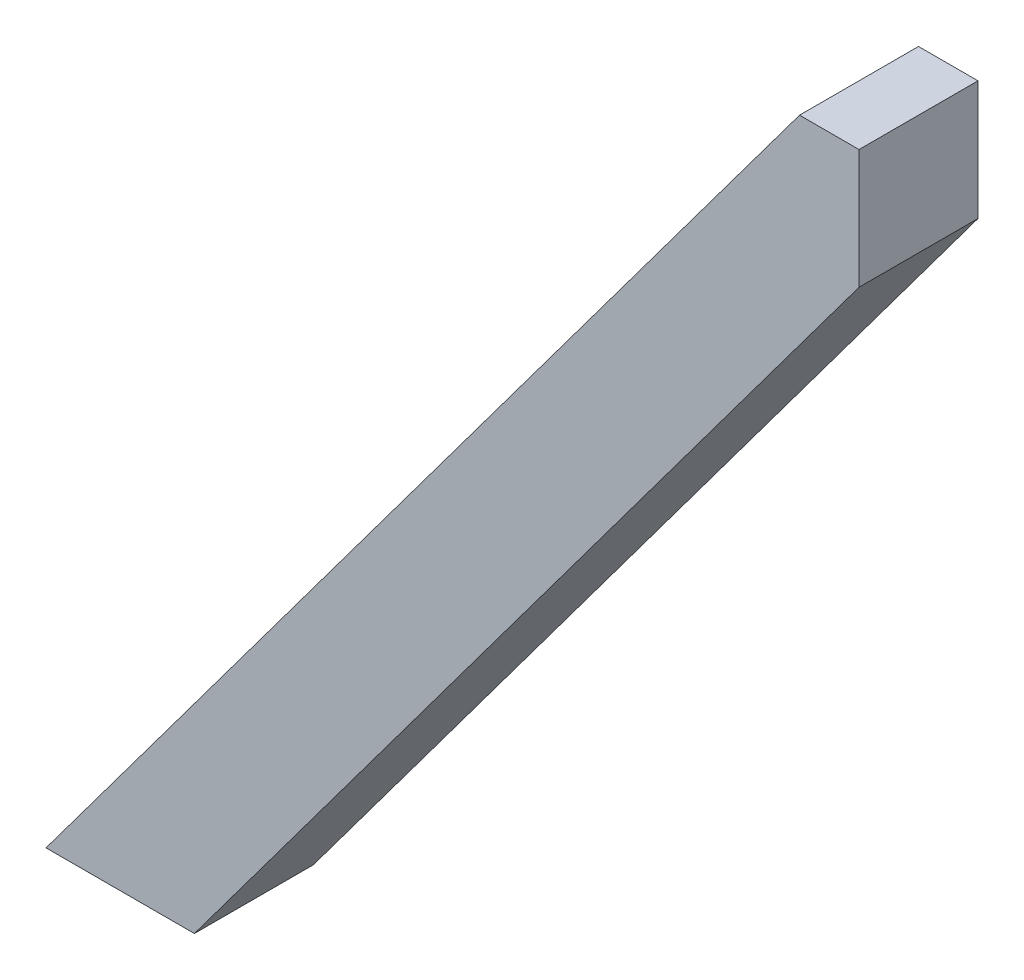
from build123d import *

# Parameters (mm, degrees)
BOSS_EXTRUDE1_DEPTH = 76.2


with BuildPart() as part:
    # Sketch1 → Boss-Extrude1 (new body)
    with BuildSketch(Plane.XY):
        Polygon((0, 0), (95.026694716, 0), (520.703129708, 571.296815506), (520.703129708, 647.69766069), (482.603129708, 647.69766069), align=None)
    extrude(amount=BOSS_EXTRUDE1_DEPTH)


solid = part.part
